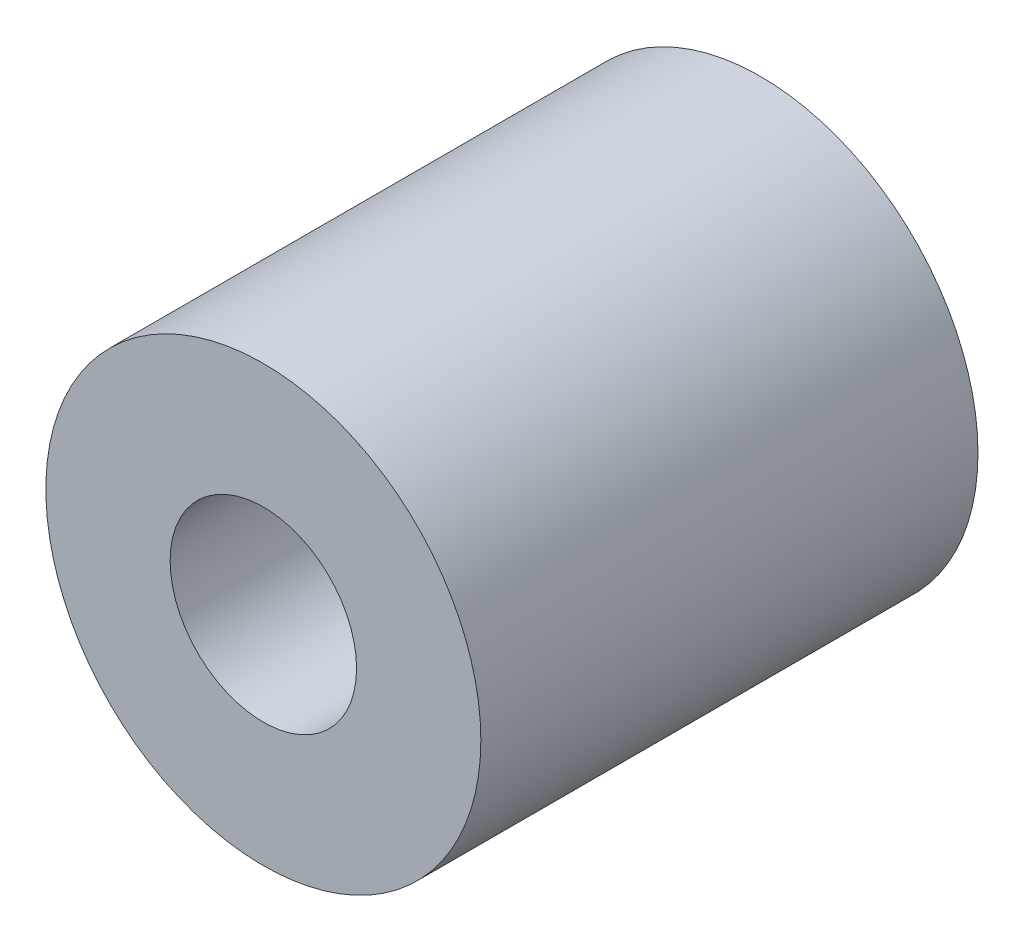
from build123d import *

# Parameters (mm, degrees)
SKETCH1_R           = 11.1125
SKETCH1_R_2         = 4.7625
BOSS_EXTRUDE1_DEPTH = 12.7


with BuildPart() as part:
    # Sketch1 → Boss-Extrude1 (new, symmetric)
    with BuildSketch(Plane.XY):
        Circle(SKETCH1_R)
        Circle(SKETCH1_R_2, mode=Mode.SUBTRACT)
    extrude(amount=BOSS_EXTRUDE1_DEPTH, both=True)


solid = part.part
